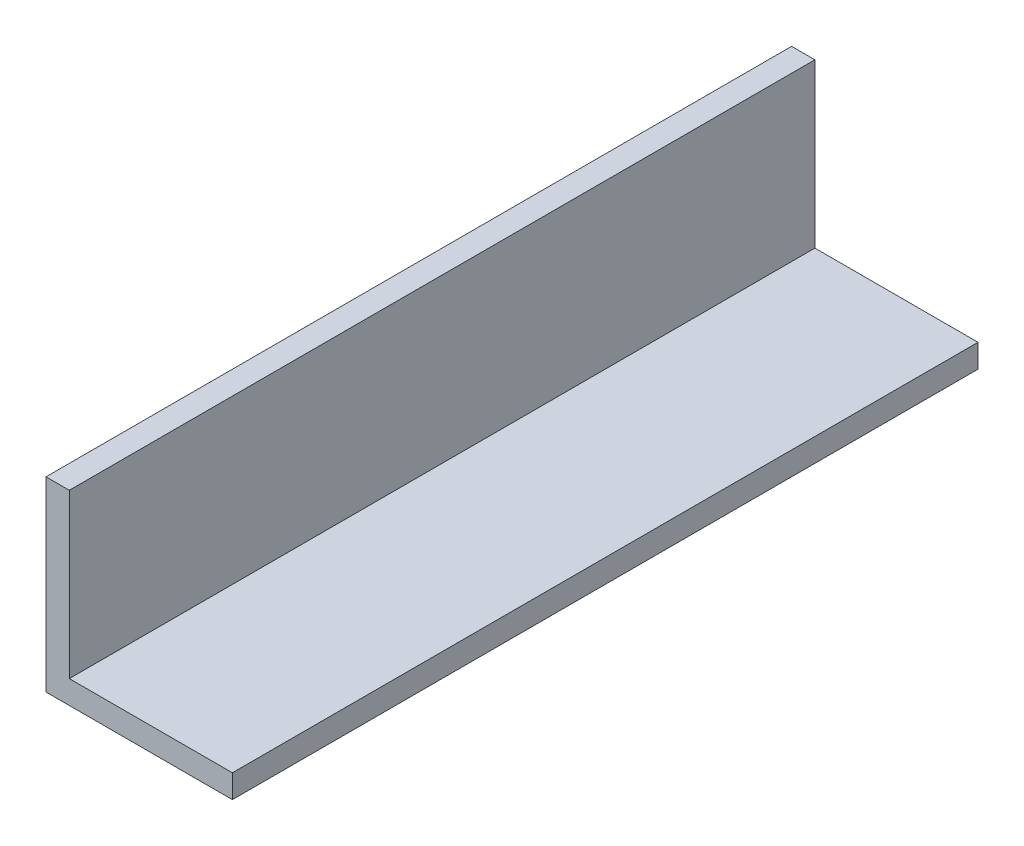
from build123d import *

# Parameters (mm, degrees)
EXTRUDE_1_DEPTH = 160


with BuildPart() as part:
    # Эскиз1 → Вытянуть1 (new body)
    with BuildSketch(Plane.XY):
        Polygon((0, 4.794391972), (0, -30.205608028), (35, -30.205608028), (35, -35.205608028), (-5, -35.205608028), (-5, 4.794391972), align=None)
    extrude(amount=EXTRUDE_1_DEPTH)


solid = part.part
